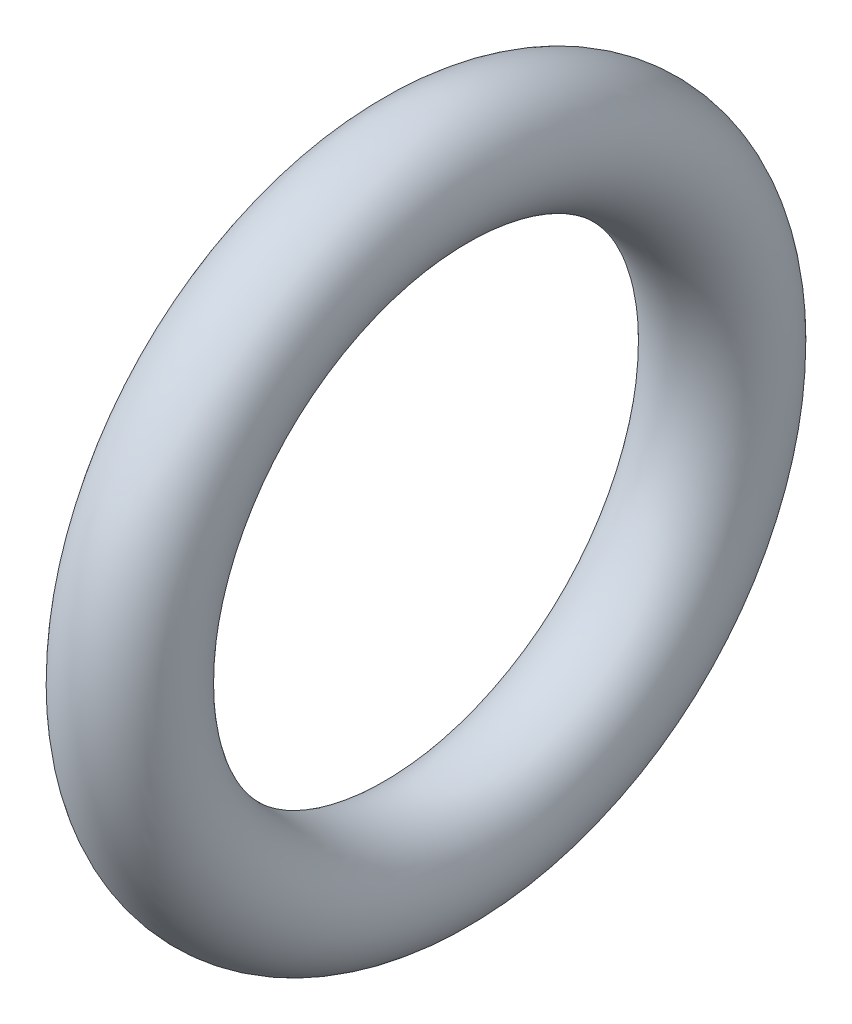
from build123d import *

# Parameters (mm, degrees)
ESBO_O1_R = 1


with BuildPart() as part:
    # Esboço1 → Revolução2 (revolve)
    with BuildSketch(Plane.XY, mode=Mode.PRIVATE) as revolu_o2_sk:
        with Locations((0, 5)):
            Circle(ESBO_O1_R)
    revolve(revolu_o2_sk.sketch.rotate(Axis((0, 0, 0), (1, 0, 0)), 90), axis=Axis((0, 0, 0), (1, 0, 0)))


solid = part.part
